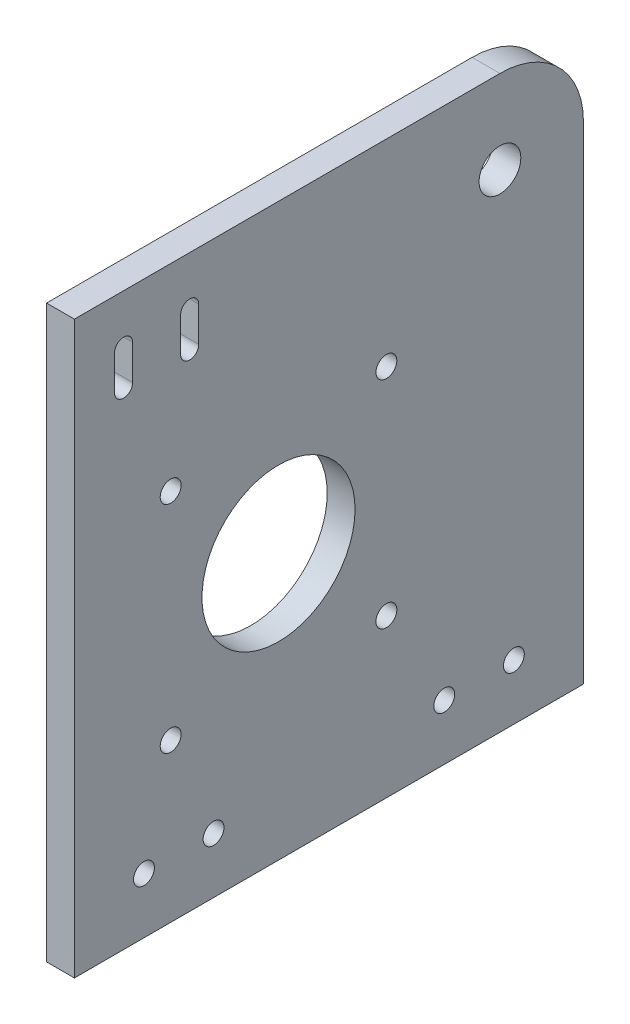
from build123d import *

# Parameters (mm, degrees)
SKETCH_1_R          = 1.5
SKETCH_1_R_2        = 11
SKETCH_1_R_3        = 3
EXTRUDE_1_DEPTH     = 4
CUT_EXTRUDE_1_DEPTH = 10


with BuildPart() as part:
    # 草图1 → 凸台-拉伸1 (new body)
    with BuildSketch(Plane(origin=(0, 0, 0), x_dir=(0, 0, -1), z_dir=(1, 0, 0))):
        with BuildLine():
            Line((-61.155133648, -62), (-61.155133648, -70))
            Line((-61.155133648, -70), (12, -70))
            Line((12, -70), (12, -62))
            Line((12, -62), (12, 0))
            ThreePointArc((12, 0), (10.643645992, 5.541913027), (6.8812, 9.83102673))
            ThreePointArc((6.8812, 9.83102673), (3.607469975, 11.44491854), (0, 12))
            Line((0, 12), (-61.155133648, 12))
            Line((-61.155133648, 12), (-61.155133648, -62))
        make_face()
        with Locations((-51.155133648, -62)):
            Circle(SKETCH_1_R, mode=Mode.SUBTRACT)
        with Locations((-41.155133648, -62)):
            Circle(SKETCH_1_R, mode=Mode.SUBTRACT)
        with Locations((-47.319805147, -47.319805147)):
            Circle(SKETCH_1_R, mode=Mode.SUBTRACT)
        with Locations((-31.819805153, -31.819805153)):
            Circle(SKETCH_1_R_2, mode=Mode.SUBTRACT)
        with Locations((-8, -62)):
            Circle(SKETCH_1_R, mode=Mode.SUBTRACT)
        with Locations((2, -62)):
            Circle(SKETCH_1_R, mode=Mode.SUBTRACT)
        with Locations((-16.319805153, -47.319805147)):
            Circle(SKETCH_1_R, mode=Mode.SUBTRACT)
        with Locations((-47.319805147, -16.319805153)):
            Circle(SKETCH_1_R, mode=Mode.SUBTRACT)
        with Locations((-16.319805153, -16.319805153)):
            Circle(SKETCH_1_R, mode=Mode.SUBTRACT)
        Circle(SKETCH_1_R_3, mode=Mode.SUBTRACT)
    extrude(amount=EXTRUDE_1_DEPTH)

    # 草图2 → 切除-拉伸1 (cut)
    with BuildSketch(Plane(origin=(4, 0, 0), x_dir=(0, 0, -1), z_dir=(1, 0, 0))):
        with BuildLine():
            Line((-55.384065837, 4.928932188), (-55.384065837, -0.071067812))
            ThreePointArc((-55.384065837, -0.071067812), (-54.084065837, -1.371067812), (-52.784065837, -0.071067812))
            Line((-52.784065837, -0.071067812), (-52.784065837, 4.928932188))
            ThreePointArc((-52.784065837, 4.928932188), (-54.084065837, 6.228932188), (-55.384065837, 4.928932188))
        make_face()
        with BuildLine():
            Line((-45.884065837, 4.928932188), (-45.884065837, -0.071067812))
            ThreePointArc((-45.884065837, -0.071067812), (-44.584065837, -1.371067812), (-43.284065837, -0.071067812))
            Line((-43.284065837, -0.071067812), (-43.284065837, 4.928932188))
            ThreePointArc((-43.284065837, 4.928932188), (-44.584065837, 6.228932188), (-45.884065837, 4.928932188))
        make_face()
    extrude(amount=-CUT_EXTRUDE_1_DEPTH, mode=Mode.SUBTRACT)


solid = part.part
